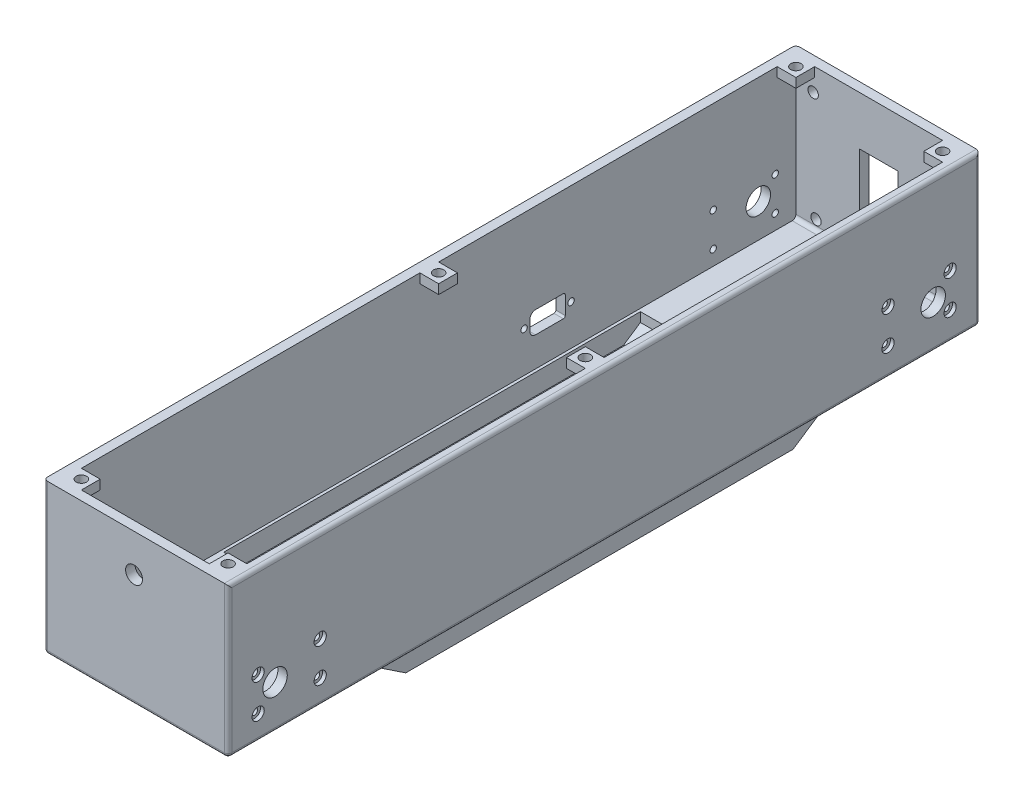
from build123d import *

# Parameters (mm, degrees)
CROQUIS1_W                                           = 98
CROQUIS1_H                                           = 80
SALIENTE_EXTRUIR1_DEPTH                              = 200
VACIADO1_T                                           = -5
REDONDEO1_R                                          = 2
CROQUIS6_R                                           = 4.5
CORTAR_EXTRUIR3_DEPTH                                = 401.03249868
REFRENTADO_PARA_TORNILLO_CON_CABEZA_PLAN_D           = 3.4
REFRENTADO_PARA_TORNILLO_CON_CABEZA_PLAN_DEPTH       = 5
REFRENTADO_PARA_TORNILLO_CON_CABEZA_PLAN_CBORE_D     = 6.5
REFRENTADO_PARA_TORNILLO_CON_CABEZA_PLAN_CBORE_DEPTH = 2
CORTAR_EXTRUIR5_REACH                                = 228.283
CROQUIS11_R                                          = 6.5
SIMETR_A3_AT_THE_SECOND_PLANE_COPY_1_REACH           = 228.283
SIMETR_A3_AT_THE_SECOND_PLANE_COPY_1_SKE_R           = 6.5
REFRENTADO_PARA_TORNILLO_CON_CABEZA_2_D              = 3.4
REFRENTADO_PARA_TORNILLO_CON_CABEZA_2_DEPTH          = 5
REFRENTADO_PARA_TORNILLO_CON_CABEZA_2_CBORE_D        = 6.5
REFRENTADO_PARA_TORNILLO_CON_CABEZA_2_CBORE_DEPTH    = 2
REFRENTADO_PARA_TORNILLO_CON_CABEZA_3_D              = 3.4
REFRENTADO_PARA_TORNILLO_CON_CABEZA_3_DEPTH          = 5
REFRENTADO_PARA_TORNILLO_CON_CABEZA_3_CBORE_D        = 6.5
REFRENTADO_PARA_TORNILLO_CON_CABEZA_3_CBORE_DEPTH    = 2
REFRENTADO_PARA_TORNILLO_CON_CABEZA_4_D              = 3.2
REFRENTADO_PARA_TORNILLO_CON_CABEZA_4_DEPTH          = 5
REFRENTADO_PARA_TORNILLO_CON_CABEZA_4_CBORE_D        = 6.5
REFRENTADO_PARA_TORNILLO_CON_CABEZA_4_CBORE_DEPTH    = 2
CROQUIS21_W                                          = 20.5
CROQUIS21_H                                          = 41
CORTAR_EXTRUIR6_DEPTH                                = 10
SALIENTE_EXTRUIR2_DEPTH                              = 42.5
CORTAR_EXTRUIR7_REACH                                = 222.909
CROQUIS24_W                                          = 85
CROQUIS24_H                                          = 221.577794898
SALIENTE_EXTRUIR7_DEPTH                              = 4
CORTAR_EXTRUIR8_REACH                                = 230.263
TALADRO_DE_MARGEN_PARA_M31_D                         = 3.4
TALADRO_DE_MARGEN_PARA_M31_DEPTH                     = 5
TALADRO_DE_MARGEN_PARA_M51_D                         = 5.5
TALADRO_DE_MARGEN_PARA_M51_DEPTH                     = 5
CROQUIS30_W                                          = 10
CROQUIS30_H                                          = 10
SALIENTE_EXTRUIR8_DEPTH                              = 5
TALADRO_DE_MARGEN_PARA_M52_D                         = 5.5
TALADRO_DE_MARGEN_PARA_M52_DEPTH                     = 5


with BuildPart() as part:
    # Croquis1 → Saliente-Extruir1 (new, symmetric)
    with BuildSketch(Plane.XY):
        Rectangle(CROQUIS1_W, CROQUIS1_H)
    extrude(amount=SALIENTE_EXTRUIR1_DEPTH, both=True)

    # Vaciado1
    vaciado1_openings = [part.faces().sort_by_distance(p)[0] for p in [
        (0, 40, 0),
    ]]
    offset(amount=VACIADO1_T, openings=vaciado1_openings, kind=Kind.INTERSECTION)

    # Redondeo1
    redondeo1_edges = [part.edges().sort_by_distance(p)[0] for p in [
        (49, 0, 200),
        (0, -35, -195),
        (0, -35, 195),
        (-49, 0, 200),
        (49, 0, -200),
        (0, -40, -200),
        (-49, 0, -200),
        (49, 40, 0),
        (49, -40, 0),
        (-49, -40, 0),
        (0, -40, 200),
    ]]
    fillet(redondeo1_edges, radius=REDONDEO1_R)

    # Croquis6 → Cortar-Extruir3 (cut, through all)
    with BuildSketch(Plane(origin=(0, 0, 195), x_dir=(-1, 0, 0), z_dir=(0, 0, -1))):
        with Locations((1, 20)):
            Circle(CROQUIS6_R)
    extrude(amount=-CORTAR_EXTRUIR3_DEPTH, mode=Mode.SUBTRACT)

    # Refrentado para tornillo con cabeza plan
    with Locations(Plane.ZY.offset(49)):
        with Locations((-184, -27.06), (-184, -9.06), (-151, -9.06), (-151, -27.06)):
            CounterBoreHole(REFRENTADO_PARA_TORNILLO_CON_CABEZA_PLAN_D / 2, REFRENTADO_PARA_TORNILLO_CON_CABEZA_PLAN_CBORE_D / 2, REFRENTADO_PARA_TORNILLO_CON_CABEZA_PLAN_CBORE_DEPTH, depth=REFRENTADO_PARA_TORNILLO_CON_CABEZA_PLAN_DEPTH)

    # Croquis11 → Cortar-Extruir5 (cut, up to next)
    with BuildSketch(Plane.ZY.offset(49), mode=Mode.PRIVATE) as cortar_extruir5_sk1:
        with Locations(Location((-175, -17.06, 0), (0, 0, 270))):
            Circle(CROQUIS11_R)
    cortar_extruir5_tool1 = extrude(cortar_extruir5_sk1.sketch, amount=-CORTAR_EXTRUIR5_REACH, mode=Mode.PRIVATE) & part.part
    cortar_extruir5 = cortar_extruir5_tool1.solids().sort_by_distance((-49, -17.06, -175))[0]
    add(cortar_extruir5, mode=Mode.SUBTRACT)

    # Simetría3: Cortar-Extruir5 across plane
    add(cortar_extruir5.mirror(Plane.XY), mode=Mode.SUBTRACT)

    # Simetría3 at the second plane: Cortar-Extruir5 across plane
    add(cortar_extruir5.mirror(Plane(origin=(0, 0, 0), x_dir=(0, 0, 1), z_dir=(1, 0, 0))), mode=Mode.SUBTRACT)

    # Simetría3 at the second plane copy 1 ske → Simetría3 at the second plane copy 1 (cut, up to next)
    with BuildSketch(Plane(origin=(49, 0, 0), x_dir=(0, 0, -1), z_dir=(1, 0, 0)), mode=Mode.PRIVATE) as simetr_a3_at_the_second_plane_copy_1_sk1:
        with Locations(Location((-175, -17.06, 0), (0, 0, 270))):
            Circle(SIMETR_A3_AT_THE_SECOND_PLANE_COPY_1_SKE_R)
    simetr_a3_at_the_second_plane_copy_1_tool1 = extrude(simetr_a3_at_the_second_plane_copy_1_sk1.sketch, amount=-SIMETR_A3_AT_THE_SECOND_PLANE_COPY_1_REACH, mode=Mode.PRIVATE) & part.part
    add(simetr_a3_at_the_second_plane_copy_1_tool1.solids().sort_by_distance((49, -17.06, 175))[0], mode=Mode.SUBTRACT)

    # Refrentado para tornillo con cabeza  2
    with Locations(Plane.ZY.offset(49)):
        with Locations((151, -25.06), (151, -7.06), (184, -7.06), (184, -25.06)):
            CounterBoreHole(REFRENTADO_PARA_TORNILLO_CON_CABEZA_2_D / 2, REFRENTADO_PARA_TORNILLO_CON_CABEZA_2_CBORE_D / 2, REFRENTADO_PARA_TORNILLO_CON_CABEZA_2_CBORE_DEPTH, depth=REFRENTADO_PARA_TORNILLO_CON_CABEZA_2_DEPTH)

    # Refrentado para tornillo con cabeza  3
    with Locations(Plane(origin=(49, 0, 0), x_dir=(0, 0, -1), z_dir=(1, 0, 0))):
        with Locations((-151, -9.06), (-184, -9.06), (-184, -27.06), (-151, -27.06)):
            CounterBoreHole(REFRENTADO_PARA_TORNILLO_CON_CABEZA_3_D / 2, REFRENTADO_PARA_TORNILLO_CON_CABEZA_3_CBORE_D / 2, REFRENTADO_PARA_TORNILLO_CON_CABEZA_3_CBORE_DEPTH, depth=REFRENTADO_PARA_TORNILLO_CON_CABEZA_3_DEPTH)

    # Refrentado para tornillo con cabeza  4
    with Locations(Plane(origin=(49, 0, 0), x_dir=(0, 0, -1), z_dir=(1, 0, 0))):
        with Locations((151, -25.06), (151, -7.06), (184, -7.06), (184, -25.06)):
            CounterBoreHole(REFRENTADO_PARA_TORNILLO_CON_CABEZA_4_D / 2, REFRENTADO_PARA_TORNILLO_CON_CABEZA_4_CBORE_D / 2, REFRENTADO_PARA_TORNILLO_CON_CABEZA_4_CBORE_DEPTH, depth=REFRENTADO_PARA_TORNILLO_CON_CABEZA_4_DEPTH)

    # Croquis21 → Cortar-Extruir6 (cut)
    with BuildSketch(Plane(origin=(0, 0, -200), x_dir=(-1, 0, 0), z_dir=(0, 0, -1))):
        with Locations((0, -6.5)):
            Rectangle(CROQUIS21_W, CROQUIS21_H)
    extrude(amount=-CORTAR_EXTRUIR6_DEPTH, mode=Mode.SUBTRACT)

    # Croquis23 → Saliente-Extruir2 (add, symmetric)
    with BuildSketch(Plane(origin=(0, 0, 0), x_dir=(0, 0, -1), z_dir=(1, 0, 0))):
        Polygon((-118, -40), (-103, -50), (103, -50), (118, -40), (110.788897449, -40), (101.788897449, -46), (-101.788897449, -46), (-110.788897449, -40), align=None)
    extrude(amount=SALIENTE_EXTRUIR2_DEPTH, both=True)

    # Croquis24 → Cortar-Extruir7 (cut, up to next)
    with BuildSketch(Plane.XZ.offset(40), mode=Mode.PRIVATE) as cortar_extruir7_sk1:
        Rectangle(CROQUIS24_W, CROQUIS24_H)
    cortar_extruir7_tool1 = extrude(cortar_extruir7_sk1.sketch, amount=-CORTAR_EXTRUIR7_REACH, mode=Mode.PRIVATE) & part.part
    add(cortar_extruir7_tool1.solids().sort_by_distance((0, -40, 0))[0], mode=Mode.SUBTRACT)

    # Croquis25 → Saliente-Extruir7 (add)
    with BuildSketch(Plane(origin=(42.5, 0, 0), x_dir=(0, 0, -1), z_dir=(1, 0, 0))):
        Polygon((103, -50), (118, -40), (-118, -40), (-103, -50), align=None)
    saliente_extruir7 = extrude(amount=SALIENTE_EXTRUIR7_DEPTH)

    # Simetría4: Saliente-Extruir7 across plane
    add(saliente_extruir7.mirror(Plane(origin=(0, 0, 0), x_dir=(0, 0, 1), z_dir=(1, 0, 0))))

    # Croquis26 → Cortar-Extruir8 (cut, up to next)
    with BuildSketch(Plane.ZY.offset(49), mode=Mode.PRIVATE) as cortar_extruir8_sk1:
        with BuildLine():
            Line((-72.325, -8.7), (-72.325, -18.3))
            ThreePointArc((-72.325, -18.3), (-72.032106781, -19.007106781), (-71.325, -19.3))
            Line((-71.325, -19.3), (-56.525, -19.3))
            ThreePointArc((-56.525, -19.3), (-54.403679656, -18.421320344), (-53.525, -16.3))
            Line((-53.525, -16.3), (-53.525, -10.7))
            ThreePointArc((-53.525, -10.7), (-54.403679656, -8.578679656), (-56.525, -7.7))
            Line((-56.525, -7.7), (-71.325, -7.7))
            ThreePointArc((-71.325, -7.7), (-72.032106781, -7.992893219), (-72.325, -8.7))
        make_face()
    cortar_extruir8_tool1 = extrude(cortar_extruir8_sk1.sketch, amount=-CORTAR_EXTRUIR8_REACH, mode=Mode.PRIVATE) & part.part
    add(cortar_extruir8_tool1.solids().sort_by_distance((-49, -13.5, -63.064313))[0], mode=Mode.SUBTRACT)

    # Taladro de margen para M31
    with Locations(Plane.ZY.offset(49)):
        with Locations((-50.425, -13.5), (-75.425, -13.5)):
            Hole(TALADRO_DE_MARGEN_PARA_M31_D / 2, depth=TALADRO_DE_MARGEN_PARA_M31_DEPTH)

    # Taladro de margen para M51
    with Locations(Plane(origin=(0, 0, -200), x_dir=(-1, 0, 0), z_dir=(0, 0, -1))):
        with Locations((-34.833889062, 27.708126477), (0, 0), (34.833889062, 27.708126477), (33.315182526, -29.997125083), (-33.315182526, -29.997125083)):
            Hole(TALADRO_DE_MARGEN_PARA_M51_D / 2, depth=TALADRO_DE_MARGEN_PARA_M51_DEPTH)

    # Croquis30 → Saliente-Extruir8 (add)
    with BuildSketch(Plane(origin=(0, 40, 0), x_dir=(1, 0, 0), z_dir=(0, 1, 0))):
        with Locations((39, 190)):
            Rectangle(CROQUIS30_W, CROQUIS30_H)
        with Locations((-39, 190)):
            Rectangle(CROQUIS30_W, CROQUIS30_H)
        with Locations((-39, -190)):
            Rectangle(CROQUIS30_W, CROQUIS30_H)
        with Locations((39, -190)):
            Rectangle(CROQUIS30_W, CROQUIS30_H)
        with Locations((39, 0)):
            Rectangle(CROQUIS30_W, CROQUIS30_H)
        with Locations((-39, 0)):
            Rectangle(CROQUIS30_W, CROQUIS30_H)
    extrude(amount=-SALIENTE_EXTRUIR8_DEPTH)

    # Taladro de margen para M52
    with Locations(Plane(origin=(0, 40, 0), x_dir=(1, 0, 0), z_dir=(0, 1, 0))):
        with Locations((-39, -190), (-39, 190), (39, 0), (39, 190), (-39, 0), (39, -190)):
            Hole(TALADRO_DE_MARGEN_PARA_M52_D / 2, depth=TALADRO_DE_MARGEN_PARA_M52_DEPTH)


solid = part.part
